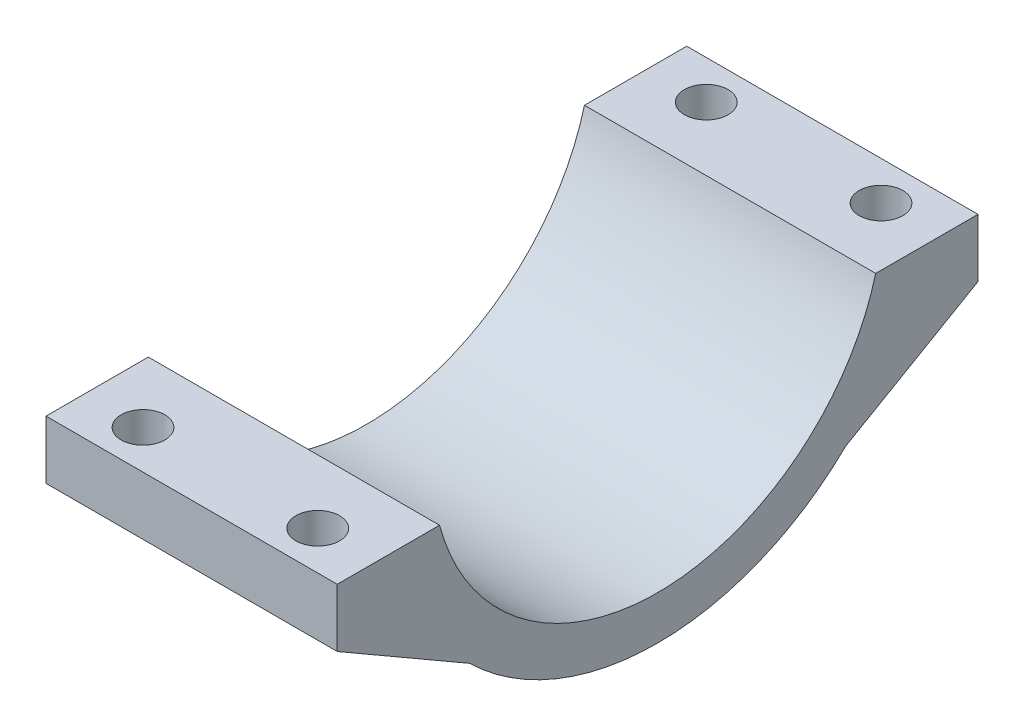
from build123d import *

# Parameters (mm, degrees)
EXTRUDE_1_DEPTH          = 20
RIB_1_REACH              = 37.018
SKETCH_3_WALL_W          = 82.524326188
SKETCH_3_WALL_H          = 1.2
RIB_2_REACH              = 32.434
SKETCH_4_WALL_W          = 73.357332182
SKETCH_4_WALL_H          = 6
MM_1_AT_2_COUNT          = 2
MM_1_AT_2_PITCH          = 12
MIRROR_2_COPY_1_REACH    = 37.018
MIRROR_2_COPY_1_SKETCH_W = 82.524326188
MIRROR_2_COPY_1_SKETCH_H = 1.2


with BuildPart() as part:
    # 草图1 → 凸台-拉伸1 (new body)
    with BuildSketch(Plane(origin=(0, 0, 0), x_dir=(0, 0, -1), z_dir=(1, 0, 0))):
        with BuildLine():
            Line((-22, -4), (-14.974979132, -4))
            ThreePointArc((-14.974979132, -4), (0, -15.5), (14.974979132, -4))
            Line((14.974979132, -4), (22, -4))
            Line((22, -4), (22, -8))
            Line((22, -8), (16.680827318, -8))
            ThreePointArc((16.680827318, -8), (0, -18.5), (-16.680827318, -8))
            Line((-16.680827318, -8), (-22, -8))
            Line((-22, -8), (-22, -4))
        make_face()
    extrude(amount=EXTRUDE_1_DEPTH)

    # 草图3 wall → 筋1 (add, up to next)
    with BuildSketch(Plane(origin=(0, -10.622155252, 17.458293879), x_dir=(0, -0.500000000025, -0.86602540377), z_dir=(0, -0.86602540377, 0.500000000025)), mode=Mode.PRIVATE) as rib_1_sk1:
        with Locations((0, 0.6)):
            Rectangle(SKETCH_3_WALL_W, SKETCH_3_WALL_H)
    rib_1_tool1 = extrude(rib_1_sk1.sketch, amount=-RIB_1_REACH, mode=Mode.PRIVATE) - part.part
    rib_1 = rib_1_tool1.solids().sort_by_distance((0, -10.622155252, 17.458293879))[0]
    add(rib_1)

    # 草图4 wall → 筋2 (add, up to next)
    with BuildSketch(Plane(origin=(10, -10.622155252, 17.458293879), x_dir=(0, -0.500000000025, -0.86602540377), z_dir=(0, -0.86602540377, 0.500000000025)), mode=Mode.PRIVATE) as rib_2_sk1:
        Rectangle(SKETCH_4_WALL_W, SKETCH_4_WALL_H)
    rib_2_tool1 = extrude(rib_2_sk1.sketch, amount=-RIB_2_REACH, mode=Mode.PRIVATE) - part.part
    rib_2 = rib_2_tool1.solids().sort_by_distance((10, -10.622155252, 17.458293879))[0]
    add(rib_2)

    # 镜向1: 筋1 across plane
    add(rib_1.mirror(Plane.ZY.offset(-10)))

    # 草图6 → 大小mm 暗销孔1 (revolve, cut)
    with BuildSketch(Plane(origin=(16, -8, 19.340413659), x_dir=(0, 0, -1), z_dir=(1, 0, 0))):
        Polygon((0, 0), (0, 5.901290929), (1.5, 5), (1.5, 0), align=None)
    mm_1 = revolve(axis=Axis((16, -14.35, 19.340413659), (0, 1, 0)), mode=Mode.SUBTRACT)

    # 大小mm 暗销孔1 at 2: 大小mm 暗销孔1 ×2
    with Locations(*[(-i * MM_1_AT_2_PITCH, 0, 0) for i in range(1, MM_1_AT_2_COUNT)]):
        add(mm_1, mode=Mode.SUBTRACT)

    # 镜向2: 筋1, 筋2, 大小mm 暗销孔1 across plane
    add(rib_1.mirror(Plane.XY))
    add(rib_2.mirror(Plane.XY))
    add(mm_1.mirror(Plane.XY), mode=Mode.SUBTRACT)

    # 镜向2 copy 1 sketch → 镜向2 copy 1 (add, up to next)
    with BuildSketch(Plane(origin=(20, -10.622155252, -17.458293879), x_dir=(0, -0.500000000025, 0.86602540377), z_dir=(0, -0.86602540377, -0.500000000025)), mode=Mode.PRIVATE) as mirror_2_copy_1_sk1:
        with Locations((0, 0.6)):
            Rectangle(MIRROR_2_COPY_1_SKETCH_W, MIRROR_2_COPY_1_SKETCH_H)
    mirror_2_copy_1_tool1 = extrude(mirror_2_copy_1_sk1.sketch, amount=-MIRROR_2_COPY_1_REACH, mode=Mode.PRIVATE) - part.part
    add(mirror_2_copy_1_tool1.solids().sort_by_distance((20, -10.622155252, -17.458293879))[0])

    # 镜向2 copy 2 sketch → 镜向2 copy 2 (revolve, cut)
    with BuildSketch(Plane(origin=(4, -8, -19.340413659), x_dir=(0, 0, 1), z_dir=(1, 0, 0))):
        Polygon((0, 0), (0, -5.901290929), (1.5, -5), (1.5, 0), align=None)
    revolve(axis=Axis((4, -14.35, -19.340413659), (0, -1, 0)), mode=Mode.SUBTRACT)


solid = part.part
